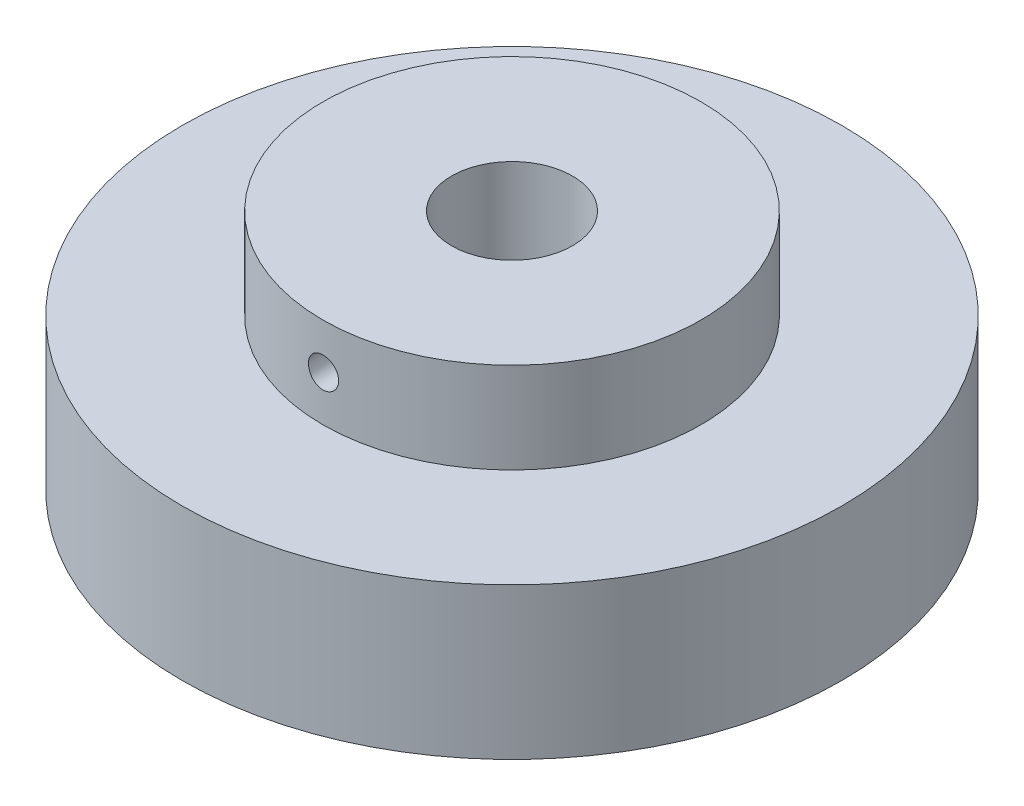
from build123d import *

# Parameters (mm, degrees)
SKETCH_1_R               = 21.8
SKETCH_1_R_2             = 4
EXTRUDE_1_DEPTH          = 10
SKETCH_2_R               = 12.5
SKETCH_2_R_2             = 4
EXTRUDE_2_DEPTH          = 6
CUT_EXTRUDE_1_REACH      = 36.734
CUT_EXTRUDE_1_END_RADIUS = 12.5
SKETCH_3_R               = 1


with BuildPart() as part:
    # 草圖1 → 填料-伸長1 (new body)
    with BuildSketch(Plane(origin=(0, 0, 0), x_dir=(1, 0, 0), z_dir=(0, 1, 0))):
        with Locations(Location((0, 0, 0), (0, 0, 270))):
            Circle(SKETCH_1_R)
        with Locations(Location((0, 0, 0), (0, 0, 270))):
            Circle(SKETCH_1_R_2, mode=Mode.SUBTRACT)
    extrude(amount=EXTRUDE_1_DEPTH)

    # 草圖2 → 填料-伸長2 (add)
    with BuildSketch(Plane(origin=(0, 10, 0), x_dir=(1, 0, 0), z_dir=(0, 1, 0))):
        with Locations(Location((0, 0, 0), (0, 0, 270))):
            Circle(SKETCH_2_R)
        with Locations(Location((0, 0, 0), (0, 0, 270))):
            Circle(SKETCH_2_R_2, mode=Mode.SUBTRACT)
    extrude(amount=EXTRUDE_2_DEPTH)

    # 除料-伸長1: up to this cylinder (the profile starts inside it)
    cut_extrude_1_end = Plane(origin=(0, 13, 0), z_dir=(0, -1, 0)) * Cylinder(CUT_EXTRUDE_1_END_RADIUS, 99.468, mode=Mode.PRIVATE)
    # 草圖3 → 除料-伸長1 (cut, up to the surface)
    with BuildSketch(Plane.XY, mode=Mode.PRIVATE) as cut_extrude_1_sk1:
        with Locations(Location((0, 13, 0), (0, 0, 180))):
            Circle(SKETCH_3_R)
    cut_extrude_1_tool1 = extrude(cut_extrude_1_sk1.sketch, amount=CUT_EXTRUDE_1_REACH, mode=Mode.PRIVATE) & cut_extrude_1_end
    add(cut_extrude_1_tool1.solids().sort_by_distance((0, 13, 0))[0], mode=Mode.SUBTRACT)


solid = part.part
